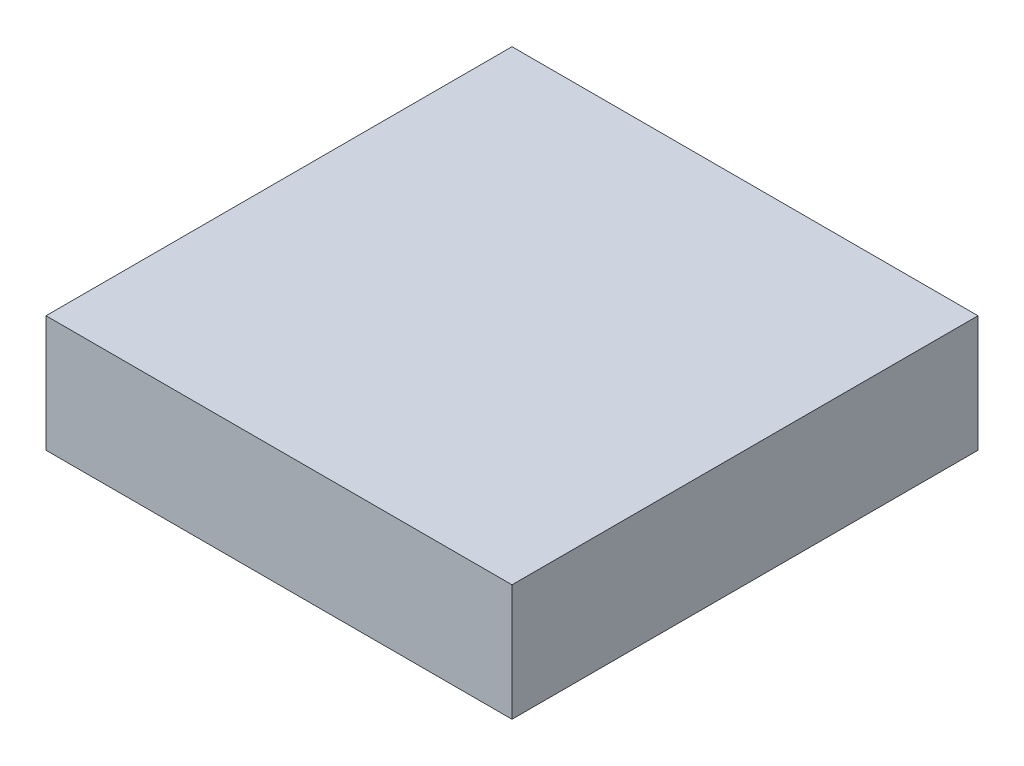
from build123d import *

# Parameters (mm, degrees)
SKETCH1_W           = 3
SKETCH1_H           = 3
BOSS_EXTRUDE1_DEPTH = 0.75


with BuildPart() as part:
    # Sketch1 → Boss-Extrude1 (new body)
    with BuildSketch(Plane(origin=(0, 0, 0), x_dir=(1, 0, 0), z_dir=(0, 1, 0))):
        Rectangle(SKETCH1_W, SKETCH1_H)
    extrude(amount=BOSS_EXTRUDE1_DEPTH)


solid = part.part
